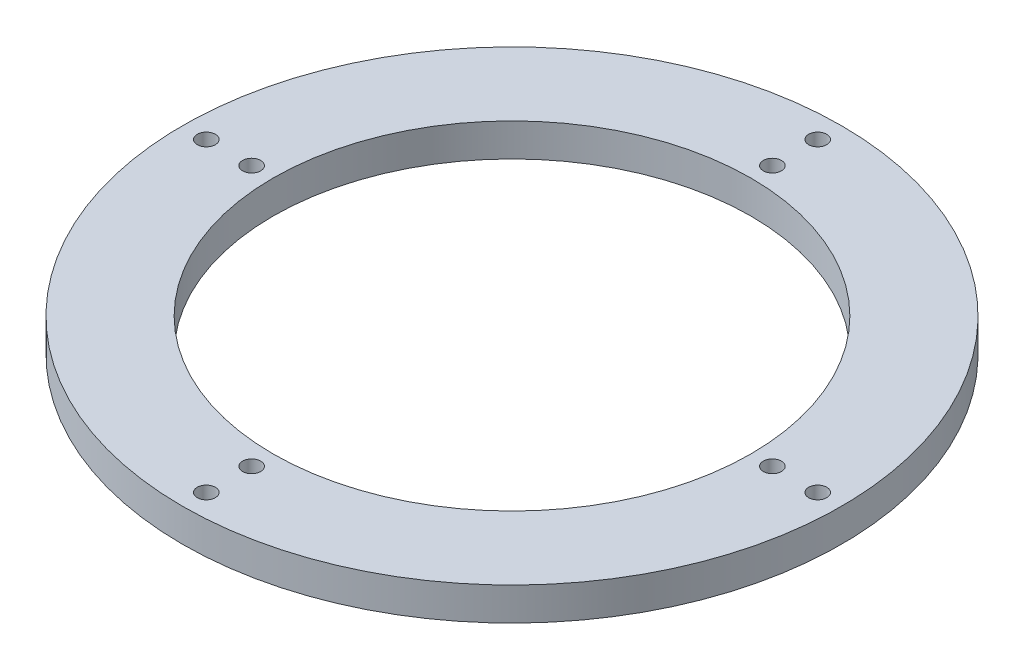
from build123d import *

# Parameters (mm, degrees)
SKETCH1_R           = 100
SKETCH1_R_2         = 72.5
SKETCH1_R_3         = 2.75
BOSS_EXTRUDE1_DEPTH = 10


with BuildPart() as part:
    # Sketch1 → Boss-Extrude1 (new body)
    with BuildSketch(Plane(origin=(0, 0, 0), x_dir=(1, 0, 0), z_dir=(0, 1, 0))):
        with Locations(Location((0, 0, 0), (0, 0, 270))):
            Circle(SKETCH1_R)
        with Locations(Location((0, 0, 0), (0, 0, 270))):
            Circle(SKETCH1_R_2, mode=Mode.SUBTRACT)
        with Locations(Location((-79.011171343, 0, 0), (0, 0, 270))):
            Circle(SKETCH1_R_3, mode=Mode.SUBTRACT)
        with Locations(Location((-92.761171343, 0, 0), (0, 0, 270))):
            Circle(SKETCH1_R_3, mode=Mode.SUBTRACT)
        with Locations(Location((0, 79.011171343, 0), (0, 0, 270))):
            Circle(SKETCH1_R_3, mode=Mode.SUBTRACT)
        with Locations(Location((0, 92.761171343, 0), (0, 0, 270))):
            Circle(SKETCH1_R_3, mode=Mode.SUBTRACT)
        with Locations(Location((79.011171343, 0, 0), (0, 0, 270))):
            Circle(SKETCH1_R_3, mode=Mode.SUBTRACT)
        with Locations(Location((92.761171343, 0, 0), (0, 0, 270))):
            Circle(SKETCH1_R_3, mode=Mode.SUBTRACT)
        with Locations(Location((0, -79.011171343, 0), (0, 0, 270))):
            Circle(SKETCH1_R_3, mode=Mode.SUBTRACT)
        with Locations(Location((0, -92.761171343, 0), (0, 0, 270))):
            Circle(SKETCH1_R_3, mode=Mode.SUBTRACT)
    extrude(amount=BOSS_EXTRUDE1_DEPTH)


solid = part.part
